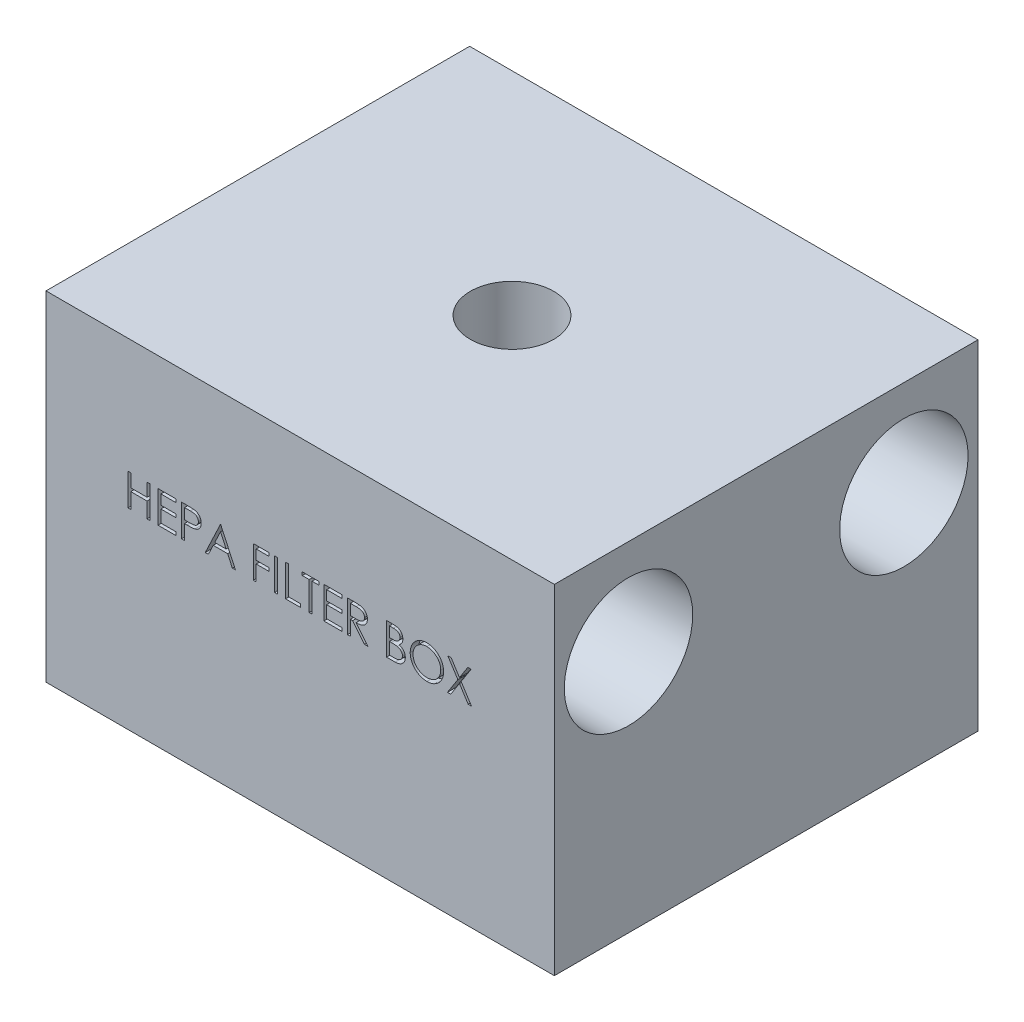
from build123d import *

# Parameters (mm, degrees)
SKETCH1_W           = 152.4
SKETCH1_H           = 127
BOSS_EXTRUDE1_DEPTH = 101.6
SKETCH2_R           = 19.25
CUT_EXTRUDE1_DEPTH  = 50.8
SKETCH3_R           = 12.5
CUT_EXTRUDE2_DEPTH  = 50.8
SKETCH4_W           = 0.854807692
SKETCH4_H           = 9.525
CUT_EXTRUDE3_DEPTH  = 2.54


with BuildPart() as part:
    # Sketch1 → Boss-Extrude1 (new body)
    with BuildSketch(Plane(origin=(0, 0, 0), x_dir=(1, 0, 0), z_dir=(0, 1, 0))):
        Rectangle(SKETCH1_W, SKETCH1_H)
    extrude(amount=BOSS_EXTRUDE1_DEPTH)

    # Sketch2 → Cut-Extrude1 (cut)
    with BuildSketch(Plane(origin=(76.2, 0, 0), x_dir=(0, 0, -1), z_dir=(1, 0, 0))):
        with Locations((-41.275, 73.025)):
            Circle(SKETCH2_R)
        with Locations((41.275, 73.025)):
            Circle(SKETCH2_R)
    extrude(amount=-CUT_EXTRUDE1_DEPTH, mode=Mode.SUBTRACT)

    # Sketch3 → Cut-Extrude2 (cut)
    with BuildSketch(Plane(origin=(0, 101.6, 0), x_dir=(1, 0, 0), z_dir=(0, 1, 0))):
        Circle(SKETCH3_R)
    extrude(amount=-CUT_EXTRUDE2_DEPTH, mode=Mode.SUBTRACT)

    # Sketch4 → Cut-Extrude3 (cut)
    # profile 1 of 13: a face of its own
    with BuildSketch(Plane.XY.offset(63.5)):
        Polygon((-51.646905503, 67.076881222), (-50.792097811, 67.076881222), (-50.792097811, 63.169188914), (-45.907482426, 63.169188914), (-45.907482426, 67.076881222), (-45.052674734, 67.076881222), (-45.052674734, 57.551881222), (-45.907482426, 57.551881222), (-45.907482426, 62.192265837), (-50.792097811, 62.192265837), (-50.792097811, 57.551881222), (-51.646905503, 57.551881222), align=None)
    # profile 2 of 13: a face of its own
    with BuildSketch(Plane.XY.offset(63.5)):
        Polygon((-42.610367041, 67.076881222), (-37.237290118, 67.076881222), (-37.237290118, 66.099958145), (-41.755559349, 66.099958145), (-41.755559349, 63.169188914), (-37.237290118, 63.169188914), (-37.237290118, 62.192265837), (-41.755559349, 62.192265837), (-41.755559349, 58.528804299), (-37.237290118, 58.528804299), (-37.237290118, 57.551881222), (-42.610367041, 57.551881222), align=None)
    # profile 3 of 13: a face of its own
    with BuildSketch(Plane.XY.offset(63.5)):
        with BuildLine():
            Line((-35.527674734, 67.076881222), (-33.65969096, 67.076881222))
            add(Edge.make_bspline(
                [(-33.65969096, 67.076881222), (-33.531209851, 67.07673999), (-33.28503434, 67.076469383), (-32.932024082, 67.068264968), (-32.611413312, 67.057306613), (-32.323893347, 67.042115889), (-32.068579537, 67.02416374), (-31.846627172, 66.998984976), (-31.656291665, 66.972695172), (-31.542246256, 66.945966915), (-31.49023483, 66.933777256)],
                knots=[0, 0, 0, 0, 1.415646017, 2.712440637, 3.8905458, 4.950247383, 5.884950622, 6.709939814, 7.411656543, 8, 8, 8, 8], degree=3))
            add(Edge.make_bspline(
                [(-31.49023483, 66.933777256), (-31.424393856, 66.915756092), (-31.294263368, 66.880138411), (-31.1067541, 66.808799635), (-30.928353992, 66.724211743), (-30.758450966, 66.627808021), (-30.599132868, 66.515452307), (-30.448022714, 66.391699104), (-30.306454053, 66.253691193), (-30.175222979, 66.102976465), (-30.054705066, 65.942085037), (-29.950937858, 65.768615111), (-29.86405019, 65.585486635), (-29.789528573, 65.392826988), (-29.735893422, 65.189018322), (-29.695488645, 64.975476769), (-29.669842915, 64.752225219), (-29.667386658, 64.599662294), (-29.666136272, 64.521998409)],
                knots=[0, 0, 0, 0, 0.999701418, 1.975846123, 2.934577507, 3.890451536, 4.834027766, 5.787354733, 6.749476667, 7.726910423, 8.712836071, 9.690891519, 10.682875813, 11.679750201, 12.712814741, 13.765529915, 14.8625177, 16, 16, 16, 16], degree=3))
            add(Edge.make_bspline(
                [(-29.666136272, 64.521998409), (-29.667283149, 64.443681746), (-29.669527092, 64.290449903), (-29.696459126, 64.066278244), (-29.73273629, 63.852051768), (-29.788517554, 63.648245477), (-29.861576136, 63.456069702), (-29.947279508, 63.272587635), (-30.050648973, 63.100920814), (-30.16942526, 62.940446015), (-30.301554956, 62.791012611), (-30.446479023, 62.653703492), (-30.603612384, 62.529322399), (-30.772455658, 62.417590492), (-30.954654889, 62.32109876), (-31.14744675, 62.234673523), (-31.352506982, 62.162090137), (-31.494409109, 62.123908327), (-31.566556945, 62.104495405)],
                knots=[0, 0, 0, 0, 1.121902311, 2.195077645, 3.232258892, 4.234102512, 5.217864754, 6.176164875, 7.132989551, 8.084763148, 9.034132444, 9.988522005, 10.94243251, 11.903244335, 12.886203696, 13.894208494, 14.929344452, 16, 16, 16, 16], degree=3))
            add(Edge.make_bspline(
                [(-31.566556945, 62.104495405), (-31.626230618, 62.091805435), (-31.757008943, 62.063994628), (-31.972390208, 62.032947327), (-32.223157294, 62.006447143), (-32.508967927, 61.986577618), (-32.829565562, 61.969567687), (-33.185123626, 61.956047374), (-33.576340079, 61.948618272), (-33.849221108, 61.948235115), (-33.991692162, 61.948035068)],
                knots=[0, 0, 0, 0, 0.601384939, 1.31797006, 2.144135048, 3.087295005, 4.142315834, 5.309527816, 6.595305764, 8, 8, 8, 8], degree=3))
            Line((-33.991692162, 61.948035068), (-34.672867041, 61.948035068))
            Line((-34.672867041, 61.948035068), (-34.672867041, 57.551881222))
            Line((-34.672867041, 57.551881222), (-35.527674734, 57.551881222))
            Line((-35.527674734, 57.551881222), (-35.527674734, 67.076881222))
        make_face()
        with BuildLine():
            Line((-34.672867041, 66.099958145), (-34.672867041, 62.924958145))
            Line((-34.672867041, 62.924958145), (-33.00522882, 62.903969563))
            add(Edge.make_bspline(
                [(-33.00522882, 62.903969563), (-32.923803879, 62.90392748), (-32.766614709, 62.90384624), (-32.539548988, 62.914691741), (-32.328885141, 62.927211762), (-32.135270261, 62.945543096), (-31.958617068, 62.971454519), (-31.798631008, 62.997612177), (-31.656552616, 63.035454628), (-31.490275503, 63.086408123), (-31.304991536, 63.173310456), (-31.103421993, 63.299448371), (-30.932596326, 63.460232298), (-30.784772961, 63.641010896), (-30.667463393, 63.842122098), (-30.581586014, 64.057302562), (-30.531127579, 64.284345495), (-30.52436158, 64.439706788), (-30.520943964, 64.518182304)],
                knots=[0, 0, 0, 0, 1.160613943, 2.240541288, 3.23993089, 4.169200891, 5.011653406, 5.7853311, 6.478053781, 7.106038997, 8.262395093, 9.384106736, 10.481365981, 11.59014053, 12.70357646, 13.786202915, 14.881775077, 16, 16, 16, 16], degree=3))
            add(Edge.make_bspline(
                [(-30.520943964, 64.518182304), (-30.524380167, 64.594759258), (-30.531210911, 64.746984766), (-30.581981511, 64.970084107), (-30.667296429, 65.182996989), (-30.785560447, 65.381588028), (-30.929091665, 65.56171613), (-31.095913449, 65.718190455), (-31.28563311, 65.843979517), (-31.462112939, 65.925168662), (-31.618870452, 65.974740233), (-31.755028857, 66.009424406), (-31.908764193, 66.037116592), (-32.080126507, 66.05953981), (-32.267787605, 66.078735301), (-32.473359733, 66.091759996), (-32.696064148, 66.099383959), (-32.850670059, 66.099762116), (-32.930814758, 66.099958145)],
                knots=[0, 0, 0, 0, 1.120700087, 2.227813068, 3.331159281, 4.466773991, 5.599788987, 6.693661531, 7.80175334, 8.91857717, 9.525282508, 10.207424825, 10.974604443, 11.810962634, 12.737642355, 13.736264703, 14.826523623, 16, 16, 16, 16], degree=3))
            Line((-32.930814758, 66.099958145), (-34.672867041, 66.099958145))
        make_face(mode=Mode.SUBTRACT)
    # profile 4 of 13: a face of its own
    with BuildSketch(Plane.XY.offset(63.5)):
        Polygon((-23.804597811, 67.076881222), (-19.408443964, 57.551881222), (-20.337665719, 57.551881222), (-21.745808748, 60.604765837), (-26.063732426, 60.604765837), (-27.511944565, 57.551881222), (-28.444982426, 57.551881222), (-23.926713195, 67.076881222), align=None)
        Polygon((-23.875195767, 65.220345765), (-25.600075575, 61.581688914), (-22.196109229, 61.581688914), align=None, mode=Mode.SUBTRACT)
    # profile 5 of 13: a face of its own
    with BuildSketch(Plane.XY.offset(63.5)):
        Polygon((-14.035367041, 67.076881222), (-9.394982426, 67.076881222), (-9.394982426, 66.099958145), (-13.180559349, 66.099958145), (-13.180559349, 63.169188914), (-9.394982426, 63.169188914), (-9.394982426, 62.192265837), (-13.180559349, 62.192265837), (-13.180559349, 57.551881222), (-14.035367041, 57.551881222), align=None)
    # profile 6 of 13: a face of its own
    with BuildSketch(Plane.XY.offset(63.5)):
        with Locations((-7.257963195, 62.314381222)):
            Rectangle(SKETCH4_W, SKETCH4_H)
    # profile 7 of 13: a face of its own
    with BuildSketch(Plane.XY.offset(63.5)):
        Polygon((-4.388251657, 67.076881222), (-3.533443964, 67.076881222), (-3.533443964, 58.528804299), (0.130017574, 58.528804299), (0.130017574, 57.551881222), (-4.388251657, 57.551881222), align=None)
    # profile 8 of 13: a face of its own
    with BuildSketch(Plane.XY.offset(63.5)):
        Polygon((0.618479112, 66.099958145), (0.618479112, 67.076881222), (5.625209882, 67.076881222), (5.625209882, 66.099958145), (3.549248343, 66.099958145), (3.549248343, 57.551881222), (2.694440651, 57.551881222), (2.694440651, 66.099958145), align=None)
    # profile 9 of 13: a face of its own
    with BuildSketch(Plane.XY.offset(63.5)):
        Polygon((7.090594497, 67.076881222), (12.46367142, 67.076881222), (12.46367142, 66.099958145), (7.945402189, 66.099958145), (7.945402189, 63.169188914), (12.46367142, 63.169188914), (12.46367142, 62.192265837), (7.945402189, 62.192265837), (7.945402189, 58.528804299), (12.46367142, 58.528804299), (12.46367142, 57.551881222), (7.090594497, 57.551881222), align=None)
    # profile 10 of 13: a face of its own
    with BuildSketch(Plane.XY.offset(63.5)):
        with BuildLine():
            Line((14.173286805, 67.076881222), (16.079431637, 67.076881222))
            add(Edge.make_bspline(
                [(16.079431637, 67.076881222), (16.206634279, 67.076457806), (16.450877444, 67.0756448), (16.800780415, 67.071111545), (17.118717015, 67.058118477), (17.404521006, 67.046937261), (17.658187146, 67.026548477), (17.880493273, 67.007061288), (18.070415506, 66.98155154), (18.185384573, 66.957860353), (18.237439449, 66.947133626)],
                knots=[0, 0, 0, 0, 1.410062039, 2.707475311, 3.878576406, 4.937260626, 5.877586885, 6.699081471, 7.410979367, 8, 8, 8, 8], degree=3))
            add(Edge.make_bspline(
                [(18.237439449, 66.947133626), (18.307126048, 66.929915786), (18.44501264, 66.895847409), (18.643541034, 66.823839495), (18.832719302, 66.740510374), (19.011761609, 66.642637678), (19.179771155, 66.529494885), (19.338480273, 66.403035209), (19.488609141, 66.263950599), (19.624086291, 66.108734351), (19.751827568, 65.945893564), (19.859565187, 65.769806912), (19.952437964, 65.585670898), (20.026380585, 65.391612854), (20.085919927, 65.189514746), (20.127901336, 64.977545949), (20.153077782, 64.756672153), (20.155640975, 64.606019558), (20.156940651, 64.529630621)],
                knots=[0, 0, 0, 0, 1.027469482, 2.033020251, 3.019912614, 3.986113645, 4.951240523, 5.91722682, 6.890402269, 7.87763091, 8.8651537, 9.85103654, 10.82876324, 11.815024772, 12.821070561, 13.842952187, 14.906261191, 16, 16, 16, 16], degree=3))
            add(Edge.make_bspline(
                [(20.156940651, 64.529630621), (20.152942877, 64.402716515), (20.145142186, 64.155074222), (20.072411725, 63.795679966), (19.953277054, 63.460429046), (19.789111532, 63.149743581), (19.580052816, 62.869679611), (19.328797491, 62.623688443), (19.035205391, 62.417839824), (18.761894182, 62.275093262), (18.520464824, 62.183672561), (18.32170988, 62.119347899), (18.104901891, 62.069649265), (17.872118145, 62.025126335), (17.622389911, 61.991512081), (17.356315732, 61.96689242), (17.073705848, 61.95150533), (16.879561666, 61.949213874), (16.779687045, 61.948035068)],
                knots=[0, 0, 0, 0, 1.260483769, 2.459530307, 3.627416485, 4.787058657, 5.939039949, 7.08810263, 8.267026773, 9.491475466, 10.141966685, 10.831826277, 11.566392101, 12.351337768, 13.187381173, 14.07005841, 15.007169909, 16, 16, 16, 16], degree=3))
            Line((16.779687045, 61.948035068), (20.279056036, 57.551881222))
            Line((20.279056036, 57.551881222), (19.221994737, 57.551881222))
            Line((19.221994737, 57.551881222), (15.722625747, 61.948035068))
            Line((15.722625747, 61.948035068), (15.028094497, 61.948035068))
            Line((15.028094497, 61.948035068), (15.028094497, 57.551881222))
            Line((15.028094497, 57.551881222), (14.173286805, 57.551881222))
            Line((14.173286805, 57.551881222), (14.173286805, 67.076881222))
        make_face()
        with BuildLine():
            Line((15.028094497, 66.099958145), (15.028094497, 62.924958145))
            Line((15.028094497, 62.924958145), (16.772054834, 62.911601775))
            add(Edge.make_bspline(
                [(16.772054834, 62.911601775), (16.853480082, 62.911565752), (17.011305406, 62.91149593), (17.239635072, 62.922364707), (17.452233376, 62.934729023), (17.648287137, 62.953641171), (17.827883939, 62.97801448), (17.990934013, 63.008502601), (18.137703519, 63.044022858), (18.308877398, 63.099000139), (18.500021102, 63.186102232), (18.707751717, 63.31282691), (18.884650937, 63.472218585), (19.034105976, 63.654482062), (19.154201072, 63.854877853), (19.238870305, 64.071003829), (19.292597952, 64.297403821), (19.298934922, 64.453009957), (19.302132959, 64.531538674)],
                knots=[0, 0, 0, 0, 1.146690395, 2.22261258, 3.21895312, 4.145990853, 4.996080663, 5.770904154, 6.481378293, 7.121626537, 8.300444488, 9.431385265, 10.535395872, 11.636531494, 12.74115979, 13.810798291, 14.895190096, 16, 16, 16, 16], degree=3))
            add(Edge.make_bspline(
                [(19.302132959, 64.531538674), (19.298861472, 64.608137564), (19.292378579, 64.759928613), (19.239450145, 64.982149341), (19.149944043, 65.191881541), (19.029324238, 65.388272032), (18.882369395, 65.566541213), (18.71005449, 65.719069537), (18.517091066, 65.844934151), (18.336738734, 65.925364287), (18.175537055, 65.974676173), (18.035574909, 66.009377555), (17.877428673, 66.037257145), (17.700330461, 66.059594797), (17.505036309, 66.078794323), (17.290558751, 66.09172595), (17.058320799, 66.09938368), (16.897356651, 66.0997622), (16.814031997, 66.099958145)],
                knots=[0, 0, 0, 0, 1.101028733, 2.181837193, 3.264309656, 4.369019818, 5.486613113, 6.575447106, 7.666700264, 8.788928104, 9.402425223, 10.0903467, 10.862060571, 11.710948788, 12.657782767, 13.684531032, 14.801375019, 16, 16, 16, 16], degree=3))
            Line((16.814031997, 66.099958145), (15.028094497, 66.099958145))
        make_face(mode=Mode.SUBTRACT)
    # profile 11 of 13: a face of its own
    with BuildSketch(Plane.XY.offset(63.5)):
        with BuildLine():
            Line((25.896363728, 67.076881222), (27.754807237, 67.076881222))
            add(Edge.make_bspline(
                [(27.754807237, 67.076881222), (27.845780453, 67.07640293), (28.022109186, 67.075475881), (28.278520667, 67.061098217), (28.518683502, 67.041493943), (28.742667339, 67.010387763), (28.95036868, 66.972854426), (29.142413464, 66.927401627), (29.318191004, 66.872900628), (29.528047808, 66.786233249), (29.767317607, 66.657446626), (30.026393232, 66.467141031), (30.247929055, 66.234370542), (30.438936104, 65.971799887), (30.590794866, 65.682958965), (30.700657025, 65.374732173), (30.770210957, 65.051095147), (30.777364053, 64.82890907), (30.780979112, 64.716619804)],
                knots=[0, 0, 0, 0, 1.001505555, 1.941167018, 2.826882275, 3.653841531, 4.429895133, 5.150066043, 5.825578002, 6.45369114, 7.647487171, 8.808567382, 9.977351308, 11.170798116, 12.373658725, 13.556498008, 14.765093433, 16, 16, 16, 16], degree=3))
            add(Edge.make_bspline(
                [(30.780979112, 64.716619804), (30.778003997, 64.611429634), (30.772157613, 64.404721032), (30.716251961, 64.102386348), (30.628728999, 63.81459196), (30.507066857, 63.542388183), (30.348946424, 63.291925278), (30.161553428, 63.06118279), (29.935465844, 62.859930271), (29.766075313, 62.747418514), (29.680032598, 62.69026764)],
                knots=[0, 0, 0, 0, 1.044552857, 2.05264487, 3.044412934, 4.028983338, 5.005914585, 5.980388656, 6.974128949, 8, 8, 8, 8], degree=3))
            add(Edge.make_bspline(
                [(29.680032598, 62.69026764), (29.788237762, 62.648725036), (29.995261044, 62.569243743), (30.280156549, 62.428721516), (30.525615378, 62.275880344), (30.733524754, 62.108970095), (30.911336514, 61.929059688), (31.06660202, 61.733511128), (31.199084902, 61.519773508), (31.312603644, 61.290075315), (31.401182759, 61.046761998), (31.467520041, 60.792115814), (31.505531457, 60.527049882), (31.51094068, 60.346658957), (31.51367142, 60.255592159)],
                knots=[0, 0, 0, 0, 1.27268992, 2.434971085, 3.483601985, 4.442670788, 5.356604649, 6.2567628, 7.179492994, 8.113709626, 9.066344395, 10.018646069, 10.999752585, 12, 12, 12, 12], degree=3))
            add(Edge.make_bspline(
                [(31.51367142, 60.255592159), (31.511013003, 60.162609457), (31.505782494, 59.979663386), (31.467192714, 59.710908342), (31.401853644, 59.454073665), (31.311852881, 59.207498133), (31.194389725, 58.971658767), (31.051438622, 58.746288384), (30.880991296, 58.533651384), (30.690320202, 58.331384953), (30.474613935, 58.149517903), (30.241888916, 57.987550158), (29.989214288, 57.854346946), (29.720739933, 57.742452631), (29.433454187, 57.656980183), (29.128647092, 57.597183393), (28.806581527, 57.556892542), (28.58557499, 57.553580006), (28.472235122, 57.551881222)],
                knots=[0, 0, 0, 0, 0.978564426, 1.925352924, 2.850884081, 3.763762016, 4.682927383, 5.618979971, 6.567305752, 7.547517671, 8.540179244, 9.531824382, 10.526200242, 11.540722885, 12.589160233, 13.674978461, 14.80764778, 16, 16, 16, 16], degree=3))
            Line((28.472235122, 57.551881222), (25.896363728, 57.551881222))
            Line((25.896363728, 57.551881222), (25.896363728, 67.076881222))
        make_face()
        with BuildLine():
            Line((26.75117142, 66.099958145), (26.75117142, 63.04707353))
            Line((26.75117142, 63.04707353), (27.325495338, 63.04707353))
            add(Edge.make_bspline(
                [(27.325495338, 63.04707353), (27.409448132, 63.048161892), (27.571662036, 63.050264829), (27.806575469, 63.056288757), (28.024629983, 63.07315629), (28.225449186, 63.090018974), (28.408716837, 63.117436245), (28.574026917, 63.150071951), (28.723973813, 63.184587571), (28.896892148, 63.243287389), (29.093033529, 63.330040205), (29.302129334, 63.464674273), (29.486463855, 63.625032692), (29.642121915, 63.810065238), (29.769515989, 64.013808215), (29.857999742, 64.233010797), (29.917999851, 64.46220987), (29.923419662, 64.619558115), (29.92617142, 64.699447328)],
                knots=[0, 0, 0, 0, 1.156816544, 2.235205308, 3.236616184, 4.169592532, 5.011045266, 5.787822928, 6.49130361, 7.128639758, 8.301311294, 9.436451833, 10.541879658, 11.654887649, 12.756523258, 13.837046038, 14.901820046, 16, 16, 16, 16], degree=3))
            add(Edge.make_bspline(
                [(29.92617142, 64.699447328), (29.924739458, 64.752313177), (29.921930509, 64.856015314), (29.89892545, 65.007188914), (29.859825122, 65.149366555), (29.809603081, 65.284496669), (29.739421007, 65.408353919), (29.65678901, 65.525220758), (29.556951525, 65.631117309), (29.443311981, 65.730094301), (29.312659943, 65.81784548), (29.165073356, 65.8947007), (28.998555463, 65.9565881), (28.815912622, 66.010788486), (28.614333449, 66.048856629), (28.396144128, 66.080570491), (28.1595575, 66.096716024), (27.9958769, 66.098853333), (27.911267574, 66.099958145)],
                knots=[0, 0, 0, 0, 0.91205012, 1.789085906, 2.630437955, 3.453916878, 4.269457761, 5.079663411, 5.91843418, 6.774407191, 7.675494373, 8.627863946, 9.638891023, 10.736472738, 11.911756761, 13.175263542, 14.539845004, 16, 16, 16, 16], degree=3))
            Line((27.911267574, 66.099958145), (26.75117142, 66.099958145))
        make_face(mode=Mode.SUBTRACT)
        with BuildLine():
            Line((26.75117142, 62.070150453), (26.75117142, 58.528804299))
            Line((26.75117142, 58.528804299), (27.968509161, 58.528804299))
            add(Edge.make_bspline(
                [(27.968509161, 58.528804299), (28.05564638, 58.52984864), (28.223591884, 58.53186147), (28.466074517, 58.538432508), (28.690818536, 58.553379344), (28.896798391, 58.576908406), (29.086238265, 58.602431185), (29.256865586, 58.636751886), (29.410063491, 58.6760737), (29.587702857, 58.736854554), (29.787737404, 58.831278521), (30.003304092, 58.973647952), (30.194964014, 59.143256382), (30.357719756, 59.339555513), (30.491105103, 59.553000767), (30.588138877, 59.779274898), (30.647985423, 60.014639083), (30.655230326, 60.17511278), (30.658863728, 60.255592159)],
                knots=[0, 0, 0, 0, 1.160039823, 2.235823828, 3.228722157, 4.157150951, 4.99529583, 5.772374946, 6.472645482, 7.099169577, 8.269452708, 9.405989375, 10.527446681, 11.663510218, 12.788923519, 13.866172445, 14.929861265, 16, 16, 16, 16], degree=3))
            add(Edge.make_bspline(
                [(30.658863728, 60.255592159), (30.65811233, 60.305920465), (30.656621653, 60.405765275), (30.63414098, 60.552493326), (30.601446091, 60.69462231), (30.559178403, 60.832538161), (30.497621139, 60.963747421), (30.425757613, 61.0908451), (30.34149837, 61.213999212), (30.210205319, 61.369698273), (30.019237275, 61.549086716), (29.747892408, 61.724720918), (29.439357797, 61.866365308), (29.215581548, 61.926507454), (29.099984521, 61.957575333)],
                knots=[0, 0, 0, 0, 0.723448775, 1.435228256, 2.130040452, 2.821711965, 3.505591119, 4.210454504, 4.921174351, 5.648778258, 7.137944449, 8.670945889, 10.280296675, 12, 12, 12, 12], degree=3))
            add(Edge.make_bspline(
                [(29.099984521, 61.957575333), (29.053641053, 61.966978097), (28.953158855, 61.987365229), (28.789308226, 62.008885479), (28.602248468, 62.028058106), (28.391547638, 62.0422399), (28.156939156, 62.056898993), (27.89792197, 62.062599899), (27.61555385, 62.069401457), (27.419631751, 62.069894401), (27.317863127, 62.070150453)],
                knots=[0, 0, 0, 0, 0.634451884, 1.375622551, 2.216452059, 3.157844607, 4.20941857, 5.370758133, 6.634282058, 8, 8, 8, 8], degree=3))
            Line((27.317863127, 62.070150453), (26.75117142, 62.070150453))
        make_face(mode=Mode.SUBTRACT)
    # profile 12 of 13: a face of its own
    with BuildSketch(Plane.XY.offset(63.5)):
        with BuildLine():
            add(Edge.make_bspline(
                [(37.924729112, 67.321111991), (38.101099744, 67.316644822), (38.447506214, 67.307870934), (38.956617186, 67.240708517), (39.442650981, 67.124516062), (39.909566859, 66.969767517), (40.351779888, 66.763335226), (40.772618588, 66.513820643), (41.171081652, 66.218609709), (41.541798412, 65.879984456), (41.881043398, 65.511548057), (42.179926703, 65.118361744), (42.43041323, 64.702802861), (42.636114551, 64.266120172), (42.797491482, 63.809301259), (42.908849737, 63.329910723), (42.979982845, 62.831054659), (42.988298925, 62.490802977), (42.992517574, 62.318197328)],
                knots=[0, 0, 0, 0, 1.065120563, 2.091984664, 3.0946048, 4.079830382, 5.057816894, 6.036188127, 7.030412546, 8.04752943, 9.064399622, 10.05169764, 11.02544977, 11.989514704, 12.962713494, 13.945757189, 14.957906945, 16, 16, 16, 16], degree=3))
            add(Edge.make_bspline(
                [(42.992517574, 62.318197328), (42.988299543, 62.146863134), (42.979985316, 61.80914359), (42.908768857, 61.313453217), (42.797078707, 60.836956393), (42.637613155, 60.380448581), (42.432892388, 59.943448211), (42.180737958, 59.527105144), (41.883717949, 59.131282887), (41.545697876, 58.760317706), (41.177213611, 58.420146017), (40.781979814, 58.123731077), (40.368885136, 57.868667567), (39.932613716, 57.66514914), (39.478951473, 57.502484128), (39.003838151, 57.391578756), (38.509500029, 57.320040445), (38.17239394, 57.31182577), (38.001051228, 57.307650453)],
                knots=[0, 0, 0, 0, 1.043624062, 2.057103931, 3.04512605, 4.022047818, 4.998200453, 5.980619268, 6.982898556, 8.009068085, 9.034988726, 10.034168286, 11.015286542, 11.987931943, 12.962482838, 13.94673481, 14.956375938, 16, 16, 16, 16], degree=3))
            add(Edge.make_bspline(
                [(38.001051228, 57.307650453), (37.828446474, 57.311866998), (37.488196558, 57.320178932), (36.988713626, 57.391429755), (36.508986337, 57.502848589), (36.050386567, 57.662077841), (35.61265858, 57.867864733), (35.194946284, 58.118792365), (34.798926319, 58.416536084), (34.427881994, 58.754446548), (34.088385962, 59.122306272), (33.79240509, 59.516462352), (33.541421031, 59.929181844), (33.336325105, 60.361610106), (33.173952541, 60.811656676), (33.063177286, 61.282323604), (32.991505873, 61.770927544), (32.983246755, 62.103602861), (32.979056036, 62.272404059)],
                knots=[0, 0, 0, 0, 1.053102029, 2.075944431, 3.073151272, 4.055350789, 5.033113405, 6.020478099, 7.024410459, 8.052272461, 9.079885166, 10.07527673, 11.055994387, 12.023226415, 12.992069828, 13.970394897, 14.97016774, 16, 16, 16, 16], degree=3))
            add(Edge.make_bspline(
                [(32.979056036, 62.272404059), (32.980511008, 62.385704394), (32.983402597, 62.61087573), (33.018214275, 62.945248406), (33.068728619, 63.274243696), (33.141123824, 63.596926062), (33.23580686, 63.912505599), (33.34752702, 64.223158746), (33.483979028, 64.525737309), (33.638231363, 64.821674682), (33.810393855, 65.106357625), (34.000555716, 65.375451348), (34.202037683, 65.631213918), (34.422918061, 65.86701755), (34.655917102, 66.089722), (34.904814545, 66.295904823), (35.168091653, 66.487425225), (35.446881272, 66.660019154), (35.734313863, 66.816117941), (36.030614237, 66.950071693), (36.331758192, 67.065041332), (36.639156198, 67.158225292), (36.951991957, 67.231791047), (37.270948242, 67.281885345), (37.595770952, 67.31678581), (37.814604613, 67.319663726), (37.924729112, 67.321111991)],
                knots=[0, 0, 0, 0, 1.037015668, 2.060948919, 3.074880161, 4.083647147, 5.086022904, 6.090072063, 7.104153813, 8.122640571, 9.144368836, 10.147691507, 11.138137339, 12.123020368, 13.103399296, 14.087645067, 15.080126199, 16.082011238, 17.087798457, 18.072939717, 19.057185487, 20.037253025, 21.01195951, 21.997135196, 22.992090687, 24, 24, 24, 24], degree=3))
        make_face()
        with BuildLine():
            add(Edge.make_bspline(
                [(37.966706276, 66.344188914), (37.876315023, 66.343087034), (37.696396664, 66.340893809), (37.428922319, 66.312003897), (37.164965699, 66.270828985), (36.904472292, 66.212096418), (36.648532033, 66.132075388), (36.394759251, 66.039979774), (36.145468083, 65.92779952), (35.901481513, 65.801055232), (35.664948344, 65.660768526), (35.441756635, 65.505723931), (35.231328583, 65.339557437), (35.034179407, 65.161881251), (34.850888003, 64.971790549), (34.677846779, 64.772167134), (34.521991704, 64.557305202), (34.379155955, 64.333031166), (34.251336333, 64.099637149), (34.137674903, 63.859580309), (34.044699994, 63.610902461), (33.968874527, 63.356301504), (33.906010041, 63.096180667), (33.866184862, 62.828566679), (33.836977513, 62.554804267), (33.834909648, 62.369796507), (33.833863728, 62.276220164)],
                knots=[0, 0, 0, 0, 1.008559885, 2.007477868, 2.99961109, 3.989939068, 4.984837346, 5.991145699, 7.001802488, 8.033829008, 9.059044045, 10.069351652, 11.065060232, 12.050310815, 13.029377138, 14.011219647, 14.996725999, 15.989392538, 16.977580475, 17.965360261, 18.951710183, 19.937753436, 20.929683414, 21.935841486, 22.955955122, 24, 24, 24, 24], degree=3))
            add(Edge.make_bspline(
                [(33.833863728, 62.276220164), (33.837333174, 62.138618692), (33.844158647, 61.867914027), (33.903914605, 61.471216436), (33.995958693, 61.089976171), (34.131641955, 60.726279261), (34.301324699, 60.376999462), (34.510947879, 60.045235263), (34.759302962, 59.730896998), (35.041415845, 59.436179159), (35.349815496, 59.167177363), (35.677292425, 58.931056944), (36.020338314, 58.731276192), (36.379847745, 58.56852096), (36.753901404, 58.439553173), (37.144909597, 58.351164899), (37.550267633, 58.292993124), (37.826576059, 58.287406695), (37.966706276, 58.28457353)],
                knots=[0, 0, 0, 0, 1.032063989, 2.030389145, 3.003944642, 3.970395727, 4.937377036, 5.913328081, 6.909231446, 7.93887556, 8.970685674, 9.976071282, 10.964166581, 11.944589148, 12.933237628, 13.927779006, 14.949070134, 16, 16, 16, 16], degree=3))
            add(Edge.make_bspline(
                [(37.966706276, 58.28457353), (38.060893562, 58.285867581), (38.24769524, 58.288434073), (38.525540912, 58.314284044), (38.798381031, 58.355736488), (39.065832907, 58.415419201), (39.327593, 58.490114813), (39.584753857, 58.578854415), (39.834576348, 58.689565405), (40.080212049, 58.811888045), (40.31533325, 58.951334474), (40.53978452, 59.101116867), (40.747908436, 59.267038613), (40.944910123, 59.442074946), (41.128954049, 59.629755132), (41.298795641, 59.829835164), (41.453863001, 60.043577953), (41.596644511, 60.267511807), (41.724016247, 60.501544466), (41.834993652, 60.742471661), (41.92914451, 60.989700137), (42.005149941, 61.243586485), (42.064709662, 61.503648509), (42.105748587, 61.770234422), (42.134455409, 62.042810918), (42.136619155, 62.227170983), (42.137709882, 62.320105381)],
                knots=[0, 0, 0, 0, 1.047197238, 2.076906641, 3.100256066, 4.114471768, 5.12198147, 6.126382909, 7.136867548, 8.15857795, 9.17633901, 10.174870724, 11.156907918, 12.133735059, 13.104061851, 14.077631395, 15.04955518, 16.038496417, 17.029181396, 18.010275684, 18.986308667, 19.968651475, 20.955262928, 21.950658345, 22.966943676, 24, 24, 24, 24], degree=3))
            add(Edge.make_bspline(
                [(42.137709882, 62.320105381), (42.136618281, 62.412404003), (42.134452891, 62.595495322), (42.105762299, 62.866170835), (42.064666305, 63.130838504), (42.005440649, 63.388459282), (41.92910416, 63.639098839), (41.834977211, 63.882521774), (41.723982931, 64.119634934), (41.596597692, 64.34985227), (41.453407487, 64.570763522), (41.29694101, 64.781952944), (41.124496741, 64.979454476), (40.941001631, 65.168143893), (40.741872293, 65.343996864), (40.52801075, 65.507071724), (40.302013312, 65.661303992), (40.062725622, 65.800438557), (39.815772433, 65.928928719), (39.562369448, 66.039013234), (39.305387398, 66.132554502), (39.045479778, 66.212338528), (38.780458958, 66.270598953), (38.512115681, 66.312041003), (38.240821206, 66.340883753), (38.058367873, 66.343083698), (37.966706276, 66.344188914)],
                knots=[0, 0, 0, 0, 1.02996197, 2.043119294, 3.035359645, 4.018872909, 4.991431989, 5.957985074, 6.929999688, 7.912076566, 8.892894881, 9.867085534, 10.843653904, 11.817741046, 12.803660682, 13.806313499, 14.818574707, 15.856120519, 16.894564902, 17.924820532, 18.937903209, 19.946497019, 20.957711757, 21.963978472, 22.977135795, 24, 24, 24, 24], degree=3))
        make_face(mode=Mode.SUBTRACT)
    # profile 13 of 13: a face of its own
    with BuildSketch(Plane.XY.offset(63.5)):
        Polygon((44.274729112, 67.076881222), (45.261192454, 67.076881222), (47.755017574, 63.180637232), (50.248842694, 67.076881222), (51.235306036, 67.076881222), (48.249203271, 62.409783866), (51.35742142, 57.551881222), (50.370958079, 57.551881222), (47.755017574, 61.638930501), (45.139077069, 57.551881222), (44.152613728, 57.551881222), (47.26273993, 62.409783866), align=None)
    extrude(amount=-CUT_EXTRUDE3_DEPTH, mode=Mode.SUBTRACT)


solid = part.part
